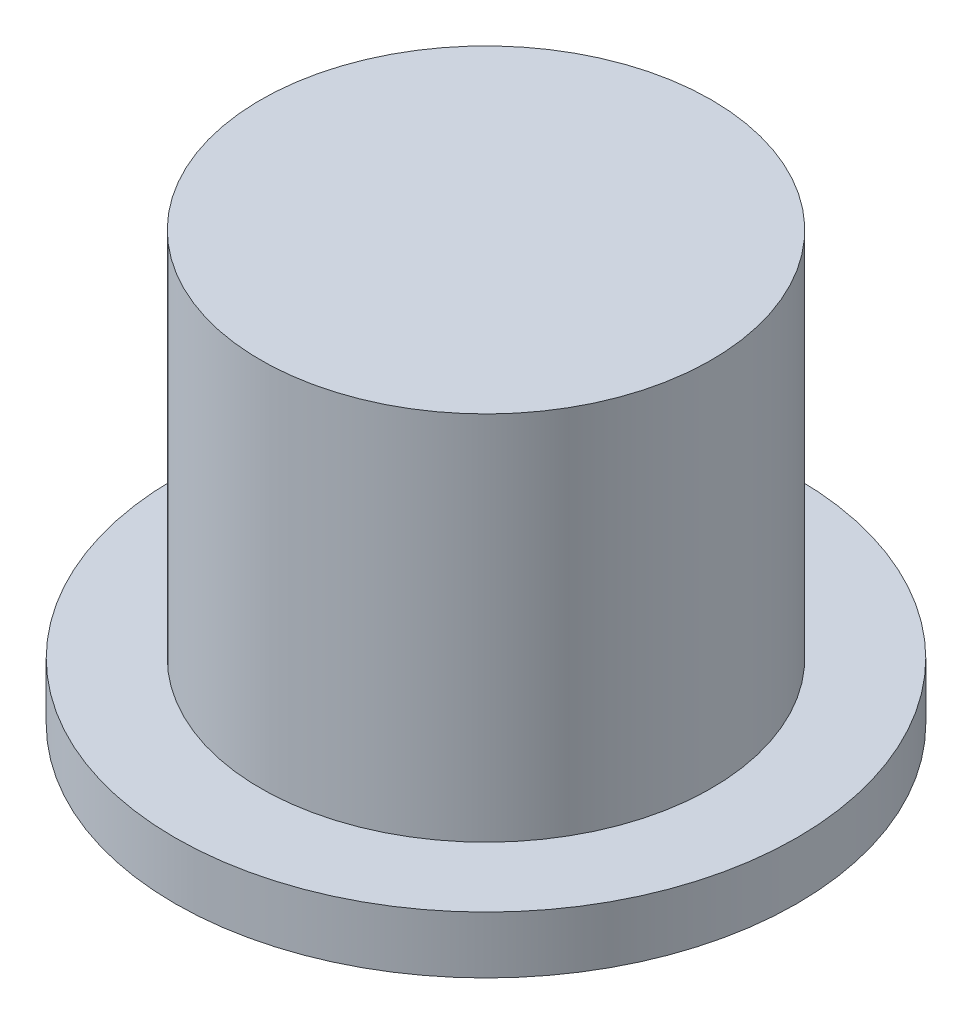
from build123d import *

# Parameters (mm, degrees)
SKETCH2_R           = 3.95
BOSS_EXTRUDE1_DEPTH = 3.25
SKETCH5_R           = 3.5
BOSS_EXTRUDE4_DEPTH = 2
SKETCH7_R           = 5.45
BOSS_EXTRUDE5_DEPTH = 1
CUT_EXTRUDE1_DEPTH  = 8.1


with BuildPart() as part:
    # Sketch2 → Boss-Extrude1 (new, symmetric)
    with BuildSketch(Plane(origin=(0, 0, 0), x_dir=(1, 0, 0), z_dir=(0, 1, 0))):
        with Locations(Location((0, 0, 0), (0, 0, 90))):
            Circle(SKETCH2_R)
    extrude(amount=BOSS_EXTRUDE1_DEPTH, both=True)

    # Sketch5 → Boss-Extrude4 (add)
    with BuildSketch(Plane.XZ.offset(3.25)):
        with Locations(Location((0, 0, 0), (0, 0, 90))):
            Circle(SKETCH5_R)
    extrude(amount=BOSS_EXTRUDE4_DEPTH)

    # Sketch7 → Boss-Extrude5 (add)
    with BuildSketch(Plane.XZ.offset(3.25)):
        with Locations(Location((0, 0, 0), (0, 0, 270))):
            Circle(SKETCH7_R)
    extrude(amount=BOSS_EXTRUDE5_DEPTH)

    # Sketch6 → Cut-Extrude1 (cut)
    with BuildSketch(Plane.XZ.offset(5.25)):
        with BuildLine():
            ThreePointArc((2.075, 0), (-0.799143979, 1.91493966), (-1.459451952, -1.475))
            Line((-1.459451952, -1.475), (1.459451952, -1.475))
            ThreePointArc((1.459451952, -1.475), (1.91493966, -0.799143979), (2.075, 0))
        make_face()
    extrude(amount=-CUT_EXTRUDE1_DEPTH, mode=Mode.SUBTRACT)


solid = part.part
